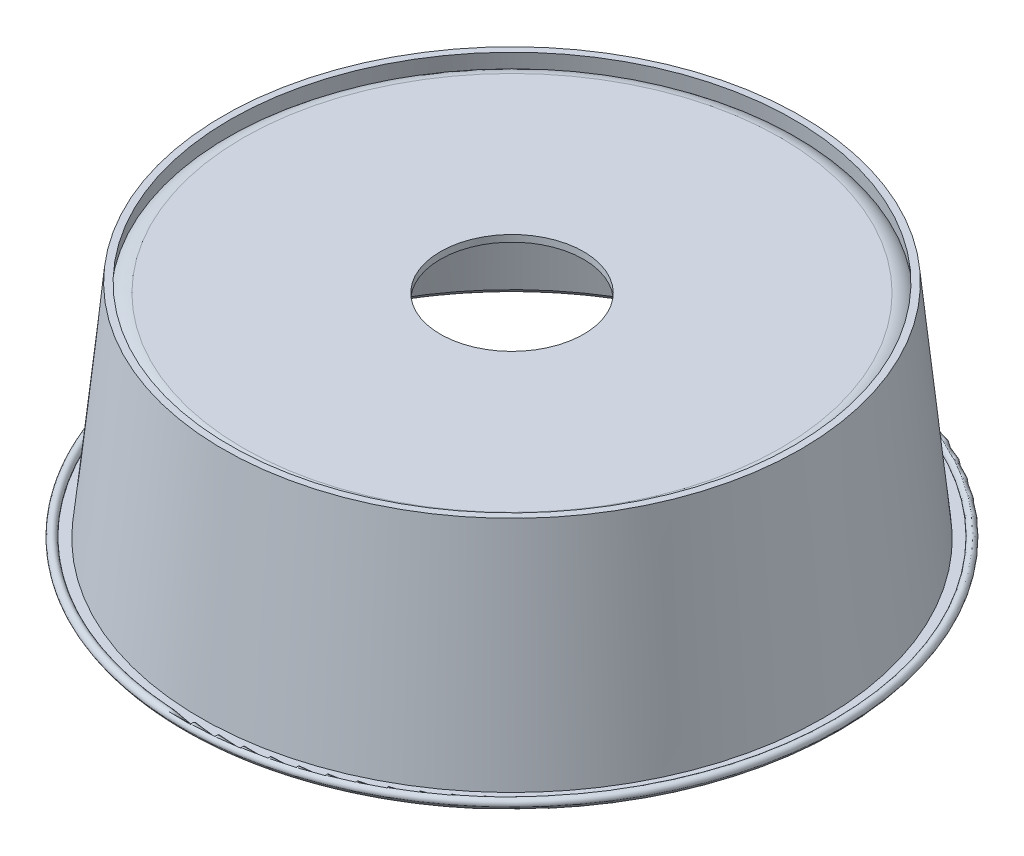
from build123d import *

# Parameters (mm, degrees)
SKETCH2_R                        = 21.5
DISTANCE_HOLE_CUT_EXTRUDE1_DEPTH = 2


with BuildPart() as part:
    # Sketch1 → Chassi Revolve1 (revolve)
    with BuildSketch(Plane.XY):
        with BuildLine():
            Line((86.7, 68.7), (93.460307941, 2.2))
            Line((93.460307941, 2.2), (96.45, 2.2))
            ThreePointArc((96.45, 2.2), (97.65, 3.9), (98.85, 2.2))
            ThreePointArc((98.85, 2.2), (97.47607781, 0.687675162), (95.552047802, 0))
            Line((95.552047802, 0), (95.052047802, 0))
            ThreePointArc((95.052047802, 0), (92.953945214, 0.613594712), (91.45, 2.2))
            Line((91.45, 2.2), (85.574123323, 60))
            ThreePointArc((85.574123323, 60), (83.601573198, 62.573512221), (80.689692059, 64))
            Line((80.689692059, 64), (0, 64))
            Line((0, 64), (0, 66))
            Line((0, 66), (80.689692059, 66))
            ThreePointArc((80.689692059, 66), (83.110250345, 65.390210948), (85.169573298, 63.979489826))
            Line((85.169573298, 63.979489826), (84.689692059, 68.7))
            Line((84.689692059, 68.7), (86.7, 68.7))
        make_face()
    revolve(axis=Axis((0, 0, 0), (0, 1, 0)))

    # Sketch2 → Distance Hole Cut-Extrude1 (cut)
    with BuildSketch(Plane(origin=(0, 66, 0), x_dir=(1, 0, 0), z_dir=(0, 1, 0))):
        with Locations(Location((0, 0, 0), (0, 0, 180))):
            Circle(SKETCH2_R)
    extrude(amount=-DISTANCE_HOLE_CUT_EXTRUDE1_DEPTH, mode=Mode.SUBTRACT)


solid = part.part
